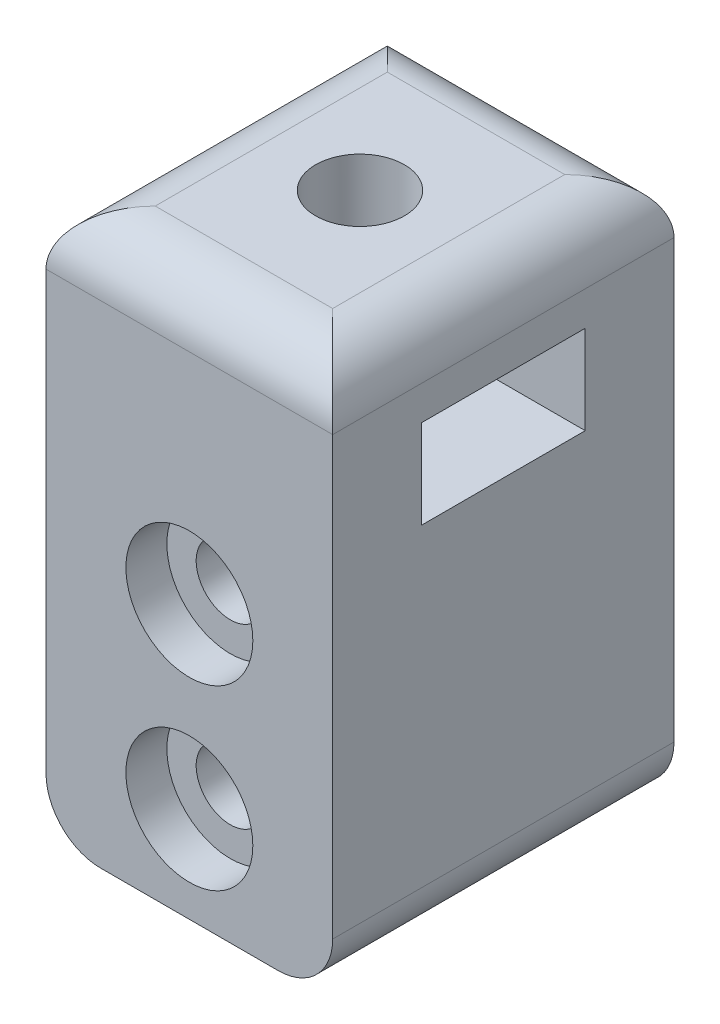
from build123d import *

# Parameters (mm, degrees)
CROQUIS1_W                 = 21
CROQUIS1_H                 = 25
SALIENTE_EXTRUIR1_DEPTH    = 20
CROQUIS2_W                 = 21
CROQUIS2_H                 = 25
SALIENTE_EXTRUIR2_DEPTH    = 20
CORTAR_EXTRUIR1_REACH      = 49.746
CROQUIS3_W                 = 12
CROQUIS3_H                 = 6.5
CROQUIS5_R                 = 3.5
CROQUIS5_W                 = 9.5
CROQUIS5_H                 = 3.5
CORTAR_EXTRUIR3_DEPTH      = 25
CROQUIS6_R                 = 4.65
CORTAR_EXTRUIR4_DEPTH      = 3
CORTAR_EXTRUIR5_REACH      = 49.266
CORTAR_EXTRUIR5_END_RADIUS = 3.5
CROQUIS7_R                 = 2.5
REDONDEO4_R                = 4
CROQUIS8_R                 = 3.25
CORTAR_EXTRUIR6_DEPTH      = 9.5
REDONDEO5_R                = 4


with BuildPart() as part:
    # Croquis1 → Saliente-Extruir1 (new body)
    with BuildSketch(Plane(origin=(0, 0, 0), x_dir=(1, 0, 0), z_dir=(0, 1, 0))):
        with Locations((1.75, -2.95)):
            Rectangle(CROQUIS1_W, CROQUIS1_H)
    extrude(amount=SALIENTE_EXTRUIR1_DEPTH)

    # Croquis2 → Saliente-Extruir2 (add)
    with BuildSketch(Plane(origin=(0, 20, 0), x_dir=(1, 0, 0), z_dir=(0, 1, 0))):
        with Locations((1.75, -2.95)):
            Rectangle(CROQUIS2_W, CROQUIS2_H)
    extrude(amount=SALIENTE_EXTRUIR2_DEPTH)

    # Croquis3 → Cortar-Extruir1 (cut, up to next)
    with BuildSketch(Plane.ZY.offset(8.75), mode=Mode.PRIVATE) as cortar_extruir1_sk1:
        with Locations((2.95, 30.25)):
            Rectangle(CROQUIS3_W, CROQUIS3_H)
    cortar_extruir1_tool1 = extrude(cortar_extruir1_sk1.sketch, amount=-CORTAR_EXTRUIR1_REACH, mode=Mode.PRIVATE) & part.part
    add(cortar_extruir1_tool1.solids().sort_by_distance((-8.75, 30.25, 2.95))[0], mode=Mode.SUBTRACT)

    # Croquis5 → Cortar-Extruir3 (cut)
    with BuildSketch(Plane.XZ):
        with Locations(Location((1.75, 0.45, 0), (0, 0, 270))):
            Circle(CROQUIS5_R)
        with Locations((1.75, 6.7)):
            Rectangle(CROQUIS5_W, CROQUIS5_H)
    extrude(amount=-CORTAR_EXTRUIR3_DEPTH, mode=Mode.SUBTRACT)

    # Croquis6 → Cortar-Extruir4 (cut)
    with BuildSketch(Plane.XY.offset(15.45)):
        with Locations((1.75, 7)):
            Circle(CROQUIS6_R)
        with Locations((1.75, 20)):
            Circle(CROQUIS6_R)
    extrude(amount=-CORTAR_EXTRUIR4_DEPTH, mode=Mode.SUBTRACT)

    # Cortar-Extruir5: up to this cylinder (the profile starts outside it)
    cortar_extruir5_end = Plane(origin=(1.75, 13.5, 0.45), z_dir=(0, -1, 0)) * Cylinder(CORTAR_EXTRUIR5_END_RADIUS, 119.532, mode=Mode.PRIVATE)
    # Croquis7 → Cortar-Extruir5 (cut, up to the surface)
    with BuildSketch(Plane.XY.offset(12.45), mode=Mode.PRIVATE) as cortar_extruir5_sk1:
        with Locations((1.75, 20)):
            Circle(CROQUIS7_R)
    cortar_extruir5_tool1 = extrude(cortar_extruir5_sk1.sketch, amount=-CORTAR_EXTRUIR5_REACH, mode=Mode.PRIVATE) - cortar_extruir5_end
    add(cortar_extruir5_tool1.solids().sort_by_distance((1.75, 20, 12.45))[0], mode=Mode.SUBTRACT)
    # Croquis7 → Cortar-Extruir5 (cut, up to the surface)
    with BuildSketch(Plane.XY.offset(12.45), mode=Mode.PRIVATE) as cortar_extruir5_sk2:
        with Locations((1.75, 7)):
            Circle(CROQUIS7_R)
    cortar_extruir5_tool2 = extrude(cortar_extruir5_sk2.sketch, amount=-CORTAR_EXTRUIR5_REACH, mode=Mode.PRIVATE) - cortar_extruir5_end
    add(cortar_extruir5_tool2.solids().sort_by_distance((1.75, 7, 12.45))[0], mode=Mode.SUBTRACT)

    # Redondeo4
    redondeo4_edges = [part.edges().sort_by_distance(p)[0] for p in [
        (12.25, 0, 2.95),
        (-8.75, 0, 2.95),
    ]]
    fillet(redondeo4_edges, radius=REDONDEO4_R)

    # Croquis8 → Cortar-Extruir6 (cut, symmetric)
    with BuildSketch(Plane.XZ.offset(-33.5)):
        with Locations(Location((1.75, 2.95, 0), (0, 0, 270))):
            Circle(CROQUIS8_R)
    extrude(amount=CORTAR_EXTRUIR6_DEPTH, both=True, mode=Mode.SUBTRACT)

    # Redondeo5
    redondeo5_edges = [part.edges().sort_by_distance(p)[0] for p in [
        (1.75, 40, 15.45),
        (12.25, 40, 2.95),
        (1.75, 40, -9.55),
        (-8.75, 40, 2.95),
    ]]
    fillet(redondeo5_edges, radius=REDONDEO5_R)


solid = part.part
